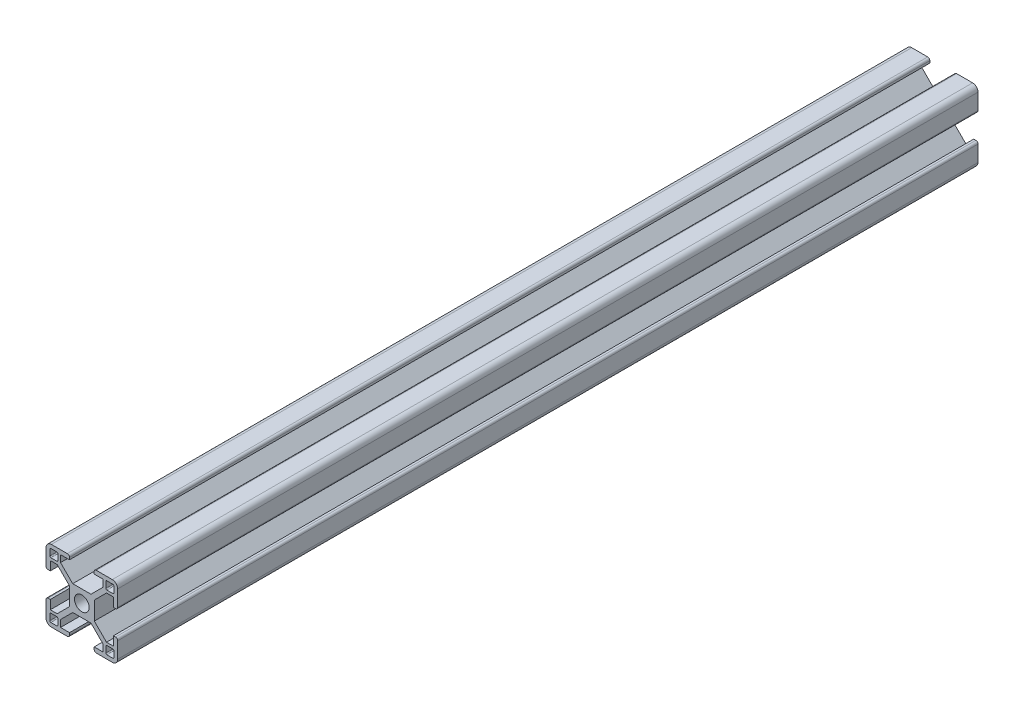
from build123d import *

# Parameters (mm, degrees)
CROQUIS1_R              = 3.4
SALIENTE_EXTRUIR1_DEPTH = 400


with BuildPart() as part:
    # Croquis1 → Saliente-Extruir1 (new body)
    with BuildSketch(Plane.XY):
        with BuildLine():
            Line((5.8, -4.24), (5.8, 4.24))
            Line((5.8, 4.24), (11.47, 9.91))
            Line((11.47, 9.91), (14.66, 9.91))
            Line((14.66, 9.91), (14.66, 5.73))
            Line((14.66, 5.73), (15.66, 5.73))
            ThreePointArc((15.66, 5.73), (16.367106781, 6.022893219), (16.66, 6.73))
            Line((16.66, 6.73), (16.66, 14.16))
            ThreePointArc((16.66, 14.16), (15.927766953, 15.927766953), (14.16, 16.66))
            Line((14.16, 16.66), (6.73, 16.66))
            ThreePointArc((6.73, 16.66), (6.022893219, 16.367106781), (5.73, 15.66))
            Line((5.73, 15.66), (5.73, 14.66))
            Line((5.73, 14.66), (9.91, 14.66))
            Line((9.91, 14.66), (9.91, 11.47))
            Line((9.91, 11.47), (4.24, 5.8))
            Line((4.24, 5.8), (-4.24, 5.8))
            Line((-4.24, 5.8), (-9.91, 11.47))
            Line((-9.91, 11.47), (-9.91, 14.66))
            Line((-9.91, 14.66), (-5.73, 14.66))
            Line((-5.73, 14.66), (-5.73, 15.66))
            ThreePointArc((-5.73, 15.66), (-6.022893219, 16.367106781), (-6.73, 16.66))
            Line((-6.73, 16.66), (-14.16, 16.66))
            ThreePointArc((-14.16, 16.66), (-15.927766953, 15.927766953), (-16.66, 14.16))
            Line((-16.66, 14.16), (-16.66, 6.73))
            ThreePointArc((-16.66, 6.73), (-16.367106781, 6.022893219), (-15.66, 5.73))
            Line((-15.66, 5.73), (-14.66, 5.73))
            Line((-14.66, 5.73), (-14.66, 9.91))
            Line((-14.66, 9.91), (-11.47, 9.91))
            Line((-11.47, 9.91), (-5.8, 4.24))
            Line((-5.8, 4.24), (-5.8, -4.24))
            Line((-5.8, -4.24), (-11.47, -9.91))
            Line((-11.47, -9.91), (-14.66, -9.91))
            Line((-14.66, -9.91), (-14.66, -5.73))
            Line((-14.66, -5.73), (-15.66, -5.73))
            ThreePointArc((-15.66, -5.73), (-16.367106781, -6.022893219), (-16.66, -6.73))
            Line((-16.66, -6.73), (-16.66, -14.16))
            ThreePointArc((-16.66, -14.16), (-15.927766953, -15.927766953), (-14.16, -16.66))
            Line((-14.16, -16.66), (-6.73, -16.66))
            ThreePointArc((-6.73, -16.66), (-6.022893219, -16.367106781), (-5.73, -15.66))
            Line((-5.73, -15.66), (-5.73, -14.66))
            Line((-5.73, -14.66), (-9.91, -14.66))
            Line((-9.91, -14.66), (-9.91, -11.47))
            Line((-9.91, -11.47), (-4.24, -5.8))
            Line((-4.24, -5.8), (4.24, -5.8))
            Line((4.24, -5.8), (9.91, -11.47))
            Line((9.91, -11.47), (9.91, -14.66))
            Line((9.91, -14.66), (5.73, -14.66))
            Line((5.73, -14.66), (5.73, -15.66))
            ThreePointArc((5.73, -15.66), (6.022893219, -16.367106781), (6.73, -16.66))
            Line((6.73, -16.66), (14.16, -16.66))
            ThreePointArc((14.16, -16.66), (15.927766953, -15.927766953), (16.66, -14.16))
            Line((16.66, -14.16), (16.66, -6.73))
            ThreePointArc((16.66, -6.73), (16.367106781, -6.022893219), (15.66, -5.73))
            Line((15.66, -5.73), (14.66, -5.73))
            Line((14.66, -5.73), (14.66, -9.91))
            Line((14.66, -9.91), (11.47, -9.91))
            Line((11.47, -9.91), (5.8, -4.24))
        make_face()
        Circle(CROQUIS1_R, mode=Mode.SUBTRACT)
        with BuildLine():
            Line((11.651495134, 14.901495134), (14.401495134, 14.901495134))
            ThreePointArc((14.401495134, 14.901495134), (14.755048524, 14.755048524), (14.901495134, 14.401495134))
            Line((14.901495134, 14.401495134), (14.901495134, 11.651495134))
            ThreePointArc((14.901495134, 11.651495134), (14.755048524, 11.297941743), (14.401495134, 11.151495134))
            Line((14.401495134, 11.151495134), (11.651495134, 11.151495134))
            ThreePointArc((11.651495134, 11.151495134), (11.297941743, 11.297941743), (11.151495134, 11.651495134))
            Line((11.151495134, 11.651495134), (11.151495134, 14.401495134))
            ThreePointArc((11.151495134, 14.401495134), (11.297941743, 14.755048524), (11.651495134, 14.901495134))
        make_face(mode=Mode.SUBTRACT)
        with BuildLine():
            Line((-14.901495134, 14.401495134), (-14.901495134, 11.651495134))
            ThreePointArc((-14.901495134, 11.651495134), (-14.755048524, 11.297941743), (-14.401495134, 11.151495134))
            Line((-14.401495134, 11.151495134), (-11.651495134, 11.151495134))
            ThreePointArc((-11.651495134, 11.151495134), (-11.297941743, 11.297941743), (-11.151495134, 11.651495134))
            Line((-11.151495134, 11.651495134), (-11.151495134, 14.401495134))
            ThreePointArc((-11.151495134, 14.401495134), (-11.297941743, 14.755048524), (-11.651495134, 14.901495134))
            Line((-11.651495134, 14.901495134), (-14.401495134, 14.901495134))
            ThreePointArc((-14.401495134, 14.901495134), (-14.755048524, 14.755048524), (-14.901495134, 14.401495134))
        make_face(mode=Mode.SUBTRACT)
        with BuildLine():
            Line((-11.651495134, -14.901495134), (-14.401495134, -14.901495134))
            ThreePointArc((-14.401495134, -14.901495134), (-14.755048524, -14.755048524), (-14.901495134, -14.401495134))
            Line((-14.901495134, -14.401495134), (-14.901495134, -11.651495134))
            ThreePointArc((-14.901495134, -11.651495134), (-14.755048524, -11.297941743), (-14.401495134, -11.151495134))
            Line((-14.401495134, -11.151495134), (-11.651495134, -11.151495134))
            ThreePointArc((-11.651495134, -11.151495134), (-11.297941743, -11.297941743), (-11.151495134, -11.651495134))
            Line((-11.151495134, -11.651495134), (-11.151495134, -14.401495134))
            ThreePointArc((-11.151495134, -14.401495134), (-11.297941743, -14.755048524), (-11.651495134, -14.901495134))
        make_face(mode=Mode.SUBTRACT)
        with BuildLine():
            Line((14.901495134, -14.401495134), (14.901495134, -11.651495134))
            ThreePointArc((14.901495134, -11.651495134), (14.755048524, -11.297941743), (14.401495134, -11.151495134))
            Line((14.401495134, -11.151495134), (11.651495134, -11.151495134))
            ThreePointArc((11.651495134, -11.151495134), (11.297941743, -11.297941743), (11.151495134, -11.651495134))
            Line((11.151495134, -11.651495134), (11.151495134, -14.401495134))
            ThreePointArc((11.151495134, -14.401495134), (11.297941743, -14.755048524), (11.651495134, -14.901495134))
            Line((11.651495134, -14.901495134), (14.401495134, -14.901495134))
            ThreePointArc((14.401495134, -14.901495134), (14.755048524, -14.755048524), (14.901495134, -14.401495134))
        make_face(mode=Mode.SUBTRACT)
    extrude(amount=SALIENTE_EXTRUIR1_DEPTH)


solid = part.part
